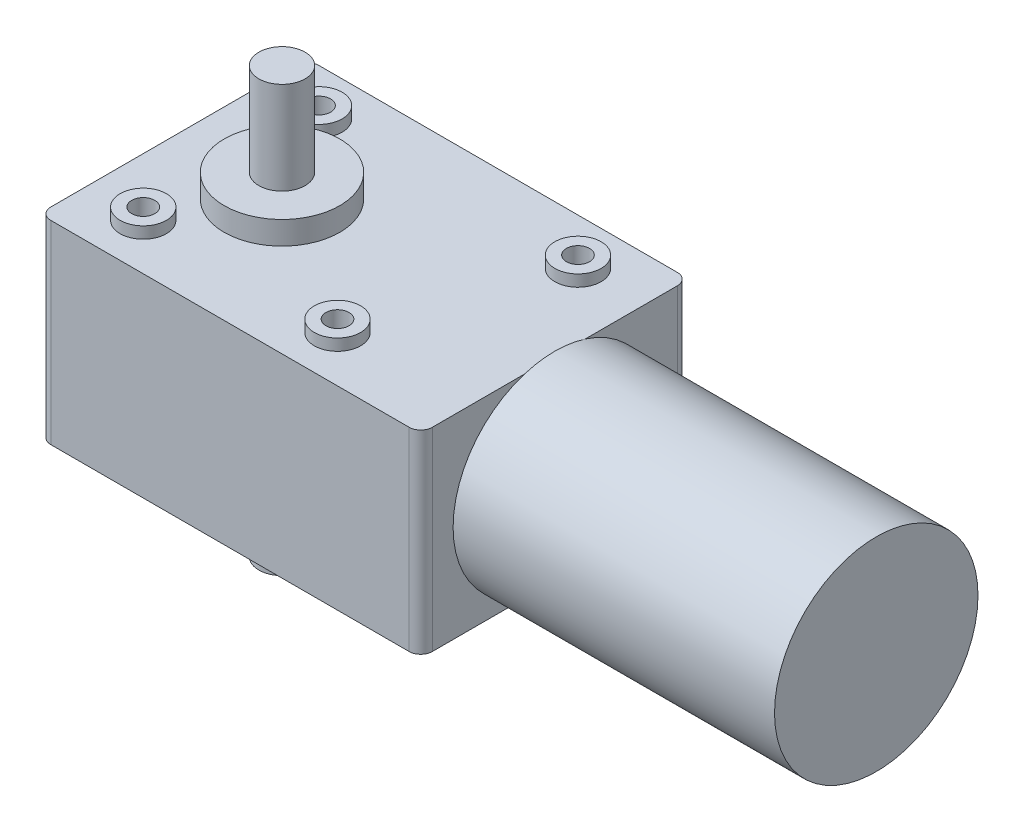
from build123d import *

# Parameters (mm, degrees)
BOSS_EXTRUDE1_DEPTH = 21
SKETCH2_R           = 5
BOSS_EXTRUDE2_DEPTH = 2.5
SKETCH3_R           = 2.5
CUT_EXTRUDE1_DEPTH  = 6
SKETCH6_R           = 12.5
BOSS_EXTRUDE5_DEPTH = 5
SKETCH4_R           = 5
BOSS_EXTRUDE3_DEPTH = 20
SKETCH5_R           = 22
BOSS_EXTRUDE4_DEPTH = 69.5


with BuildPart() as part:
    # Sketch1 → Boss-Extrude1 (new, symmetric)
    with BuildSketch(Plane(origin=(0, 0, 0), x_dir=(1, 0, 0), z_dir=(0, 1, 0))):
        with BuildLine():
            Line((-38.75, -29), (38.75, -29))
            ThreePointArc((38.75, -29), (40.517766953, -28.267766953), (41.25, -26.5))
            Line((41.25, -26.5), (41.25, 26.5))
            ThreePointArc((41.25, 26.5), (40.517766953, 28.267766953), (38.75, 29))
            Line((38.75, 29), (-38.75, 29))
            ThreePointArc((-38.75, 29), (-40.517766953, 28.267766953), (-41.25, 26.5))
            Line((-41.25, 26.5), (-41.25, -26.5))
            ThreePointArc((-41.25, -26.5), (-40.517766953, -28.267766953), (-38.75, -29))
        make_face()
    extrude(amount=BOSS_EXTRUDE1_DEPTH, both=True)

    # Sketch2 → Boss-Extrude2 (add)
    with BuildSketch(Plane(origin=(0, 21, 0), x_dir=(1, 0, 0), z_dir=(0, 1, 0))):
        with Locations(Location((-28.75, 19, 0), (0, 0, 270))):
            Circle(SKETCH2_R)
        with Locations(Location((-28.75, -19, 0), (0, 0, 270))):
            Circle(SKETCH2_R)
        with Locations(Location((13.25, -19, 0), (0, 0, 270))):
            Circle(SKETCH2_R)
        with Locations(Location((27.25, 19, 0), (0, 0, 270))):
            Circle(SKETCH2_R)
    boss_extrude2 = extrude(amount=BOSS_EXTRUDE2_DEPTH)

    # Sketch3 → Cut-Extrude1 (cut)
    with BuildSketch(Plane(origin=(0, 23.5, 0), x_dir=(1, 0, 0), z_dir=(0, 1, 0))):
        with Locations(Location((-28.75, 19, 0), (0, 0, 270))):
            Circle(SKETCH3_R)
        with Locations(Location((27.25, 19, 0), (0, 0, 270))):
            Circle(SKETCH3_R)
        with Locations(Location((13.25, -19, 0), (0, 0, 270))):
            Circle(SKETCH3_R)
        with Locations(Location((-28.75, -19, 0), (0, 0, 270))):
            Circle(SKETCH3_R)
    cut_extrude1 = extrude(amount=-CUT_EXTRUDE1_DEPTH, mode=Mode.SUBTRACT)

    # Sketch6 → Boss-Extrude5 (add)
    with BuildSketch(Plane(origin=(0, 21, 0), x_dir=(1, 0, 0), z_dir=(0, 1, 0))):
        with Locations(Location((-17.75, 0, 0), (0, 0, 270))):
            Circle(SKETCH6_R)
    boss_extrude5 = extrude(amount=BOSS_EXTRUDE5_DEPTH)

    # Sketch4 → Boss-Extrude3 (add)
    with BuildSketch(Plane(origin=(0, 26, 0), x_dir=(1, 0, 0), z_dir=(0, 1, 0))):
        with Locations(Location((-17.75, 0, 0), (0, 0, 270))):
            Circle(SKETCH4_R)
    boss_extrude3 = extrude(amount=BOSS_EXTRUDE3_DEPTH)

    # Sketch5 → Boss-Extrude4 (add)
    with BuildSketch(Plane(origin=(41.25, 0, 0), x_dir=(0, 0, -1), z_dir=(1, 0, 0))):
        with Locations(Location((0, 0, 0), (0, 0, 107.341442803))):
            Circle(SKETCH5_R)
    extrude(amount=BOSS_EXTRUDE4_DEPTH)

    # Mirror2: Boss-Extrude2, Cut-Extrude1, Boss-Extrude5, Boss-Extrude3 across plane
    add(boss_extrude2.mirror(Plane.ZX))
    add(cut_extrude1.mirror(Plane.ZX), mode=Mode.SUBTRACT)
    add(boss_extrude5.mirror(Plane.ZX))
    add(boss_extrude3.mirror(Plane.ZX))


solid = part.part
